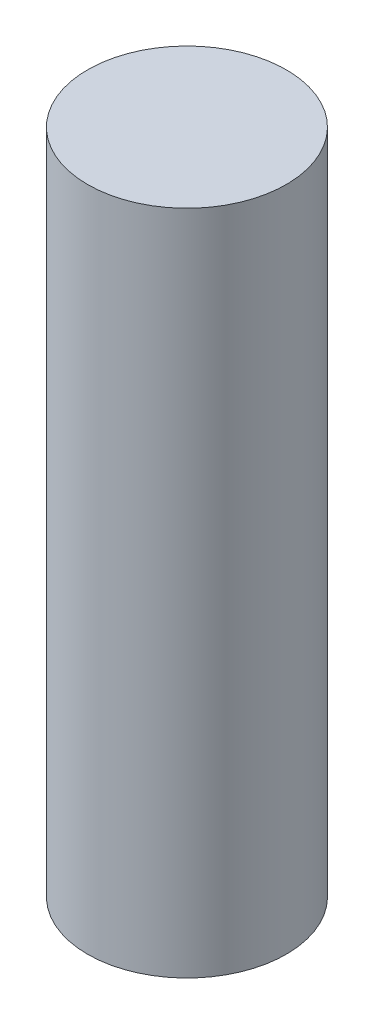
from build123d import *

# Parameters (mm, degrees)
SKETCH1_R           = 4.025
BOSS_EXTRUDE1_DEPTH = 27


with BuildPart() as part:
    # Sketch1 → Boss-Extrude1 (new body)
    with BuildSketch(Plane(origin=(0, 0, 0), x_dir=(1, 0, 0), z_dir=(0, 1, 0))):
        with Locations(Location((0, 0, 0), (0, 0, 270))):
            Circle(SKETCH1_R)
    extrude(amount=BOSS_EXTRUDE1_DEPTH)


solid = part.part
